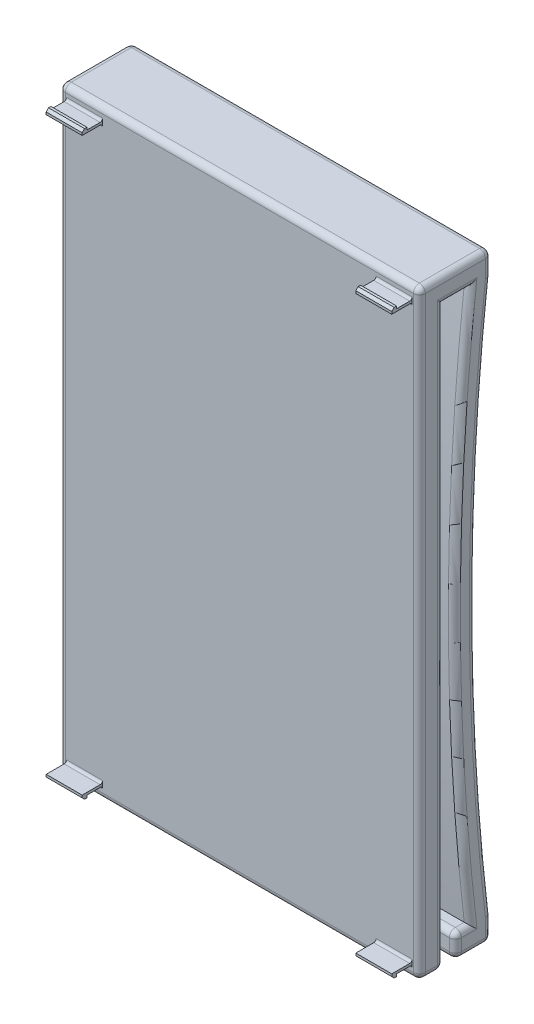
from build123d import *

# Parameters (mm, degrees)
CLIP_BODY_DEPTH                            = 15
PRISM_START                                = -0.6
PRISM_CANTILEVER_EXTRUDE_DEPTH             = 3
PRISM_CANTILEVER_EXTRUDE_FILLET_R          = 0.2
PRISM_CANTILEVER_EXTRUDE_FILLET_OF_PRISM_R = 0.2
GLOBAL_FILLET_R                            = 0.5


with BuildPart() as part:
    # Sketch1 → Clip Body (new, symmetric)
    with BuildSketch(Plane(origin=(0, 0, 0), x_dir=(0, 0, -1), z_dir=(1, 0, 0))):
        with BuildLine():
            Line((0, 0), (0, 50))
            Line((0, 50), (6, 50))
            Line((6, 50), (6, 48))
            ThreePointArc((6, 48), (4.661306176, 25), (6, 2))
            Line((6, 2), (6, 0))
            Line((6, 0), (3, 0))
            Line((3, 0), (3, 2))
            Line((3, 2), (4.238207846, 2))
            ThreePointArc((4.238207846, 2), (2.911306176, 25), (4.238207846, 48))
            Line((4.238207846, 48), (2, 48))
            Line((2, 48), (2, 0))
            Line((2, 0), (0, 0))
        make_face()
    extrude(amount=CLIP_BODY_DEPTH, both=True)

    # Sketch9 → Prism Cantilever Extrude (add)
    with BuildSketch(Plane.ZY.offset(15).offset(PRISM_START)):
        Polygon((1.7, 48.8), (1.7, 49), (1.5, 49.2), (1.3, 49.2), (1.3, 49), (0, 49), (0, 48.8), align=None)
        Polygon((1.3, 1), (0, 1), (0, 1.2), (1.7, 1.2), (1.7, 1), (1.5, 0.8), (1.3, 0.8), align=None)
    prism_cantilever_extrude = extrude(amount=-PRISM_CANTILEVER_EXTRUDE_DEPTH)

    # Prism Cantilever Extrude Fillet
    prism_cantilever_extrude_fillet_edges = [part.edges().sort_by_distance(p)[0] for p in [
        (-12.9, 1, 0),
        (-12.9, 1.2, 0),
        (-12.9, 48.8, 0),
        (-12.9, 49, 0),
    ]]
    fillet(prism_cantilever_extrude_fillet_edges, radius=PRISM_CANTILEVER_EXTRUDE_FILLET_R)

    # Prism Cantilever Extrude Mirror: Prism Cantilever Extrude across plane
    add(prism_cantilever_extrude.mirror(Plane(origin=(0, 0, 0), x_dir=(0, 0, 1), z_dir=(1, 0, 0))))

    # Prism Cantilever Extrude Fillet of Prism
    prism_cantilever_extrude_fillet_of_prism_edges = [part.edges().sort_by_distance(p)[0] for p in [
        (12.9, 1, 0),
        (12.9, 1.2, 0),
        (12.9, 48.8, 0),
        (12.9, 49, 0),
    ]]
    fillet(prism_cantilever_extrude_fillet_of_prism_edges, radius=PRISM_CANTILEVER_EXTRUDE_FILLET_OF_PRISM_R)

    # Global Fillet
    global_fillet_edges = [part.edges().sort_by_distance(p)[0] for p in [
        (-15, 25, 0),
        (-15, 50, -3),
        (15, 48, -3.119103923),
        (-15, 49, -6),
        (-15, 25, -4.661306176),
        (-15, 1, -6),
        (-15, 0, -4.5),
        (-15, 1, -3),
        (-15, 2, -3.619103923),
        (-15, 25, -2.911306176),
        (-15, 48, -3.119103923),
        (-15, 24, -2),
        (-15, 0, -1),
        (15, 25, -2.911306176),
        (0, 0, 0),
        (0, 50, 0),
        (0, 50, -6),
        (15, 2, -3.619103923),
        (0, 48, -6),
        (0, 2, -6),
        (0, 0, -6),
        (0, 0, -3),
        (0, 2, -3),
        (0, 0, -2),
        (15, 1, -3),
        (15, 0, -4.5),
        (15, 1, -6),
        (15, 25, -4.661306176),
        (15, 49, -6),
        (15, 50, -3),
        (15, 25, 0),
        (15, 0, -1),
        (15, 24, -2),
    ]]
    fillet(global_fillet_edges, radius=GLOBAL_FILLET_R)


solid = part.part
